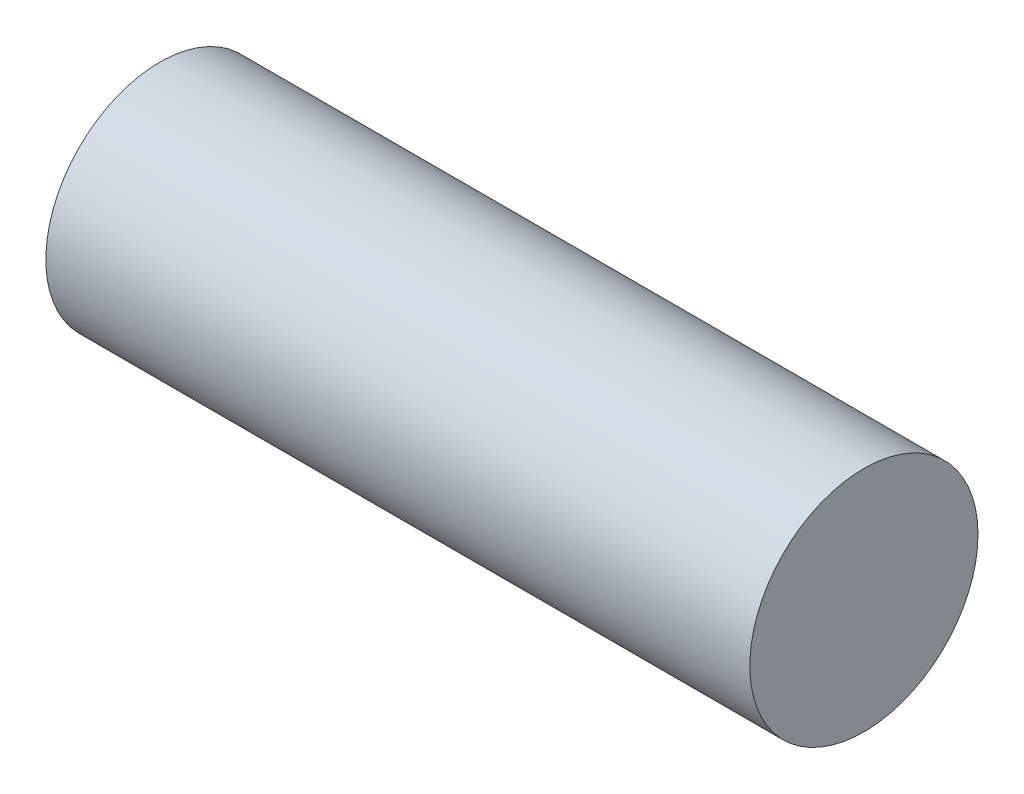
from build123d import *

# Parameters (mm, degrees)
SKETCH1_R           = 5.71
BOSS_EXTRUDE1_DEPTH = 35.23


with BuildPart() as part:
    # Sketch1 → Boss-Extrude1 (new body)
    with BuildSketch(Plane.YZ):
        with Locations(Location((0, 0, 0), (0, 0, 270))):
            Circle(SKETCH1_R)
    extrude(amount=BOSS_EXTRUDE1_DEPTH)


solid = part.part
